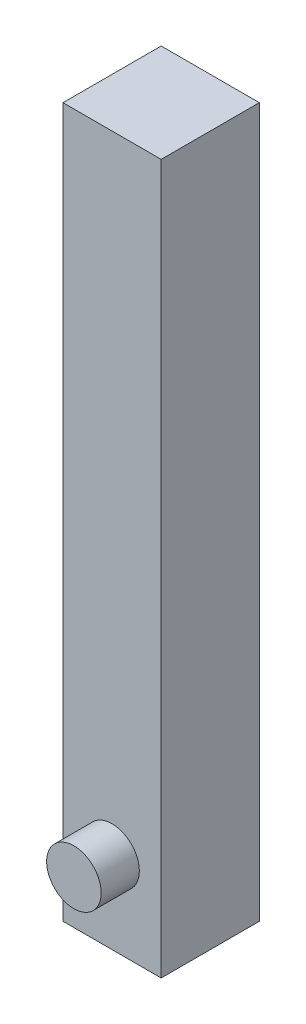
from build123d import *

# Parameters (mm, degrees)
SKETCH1_W           = 65
SKETCH1_H           = 9
BOSS_EXTRUDE1_DEPTH = 6.25
SKETCH3_W           = 9
SKETCH3_H           = 65
SKETCH3_R           = 2.5
CUT_EXTRUDE2_DEPTH  = 3.5


with BuildPart() as part:
    # Sketch1 → Boss-Extrude1 (new, symmetric)
    with BuildSketch(Plane(origin=(0, 0, 0), x_dir=(0, 1, 0), z_dir=(0, 0, 1))):
        Rectangle(SKETCH1_W, SKETCH1_H)
    extrude(amount=BOSS_EXTRUDE1_DEPTH, both=True)

    # Sketch3 → Cut-Extrude2 (cut)
    with BuildSketch(Plane.XY.offset(6.25)):
        Rectangle(SKETCH3_W, SKETCH3_H)
        with Locations((0, -25)):
            Circle(SKETCH3_R, mode=Mode.SUBTRACT)
    extrude(amount=-CUT_EXTRUDE2_DEPTH, mode=Mode.SUBTRACT)


solid = part.part
